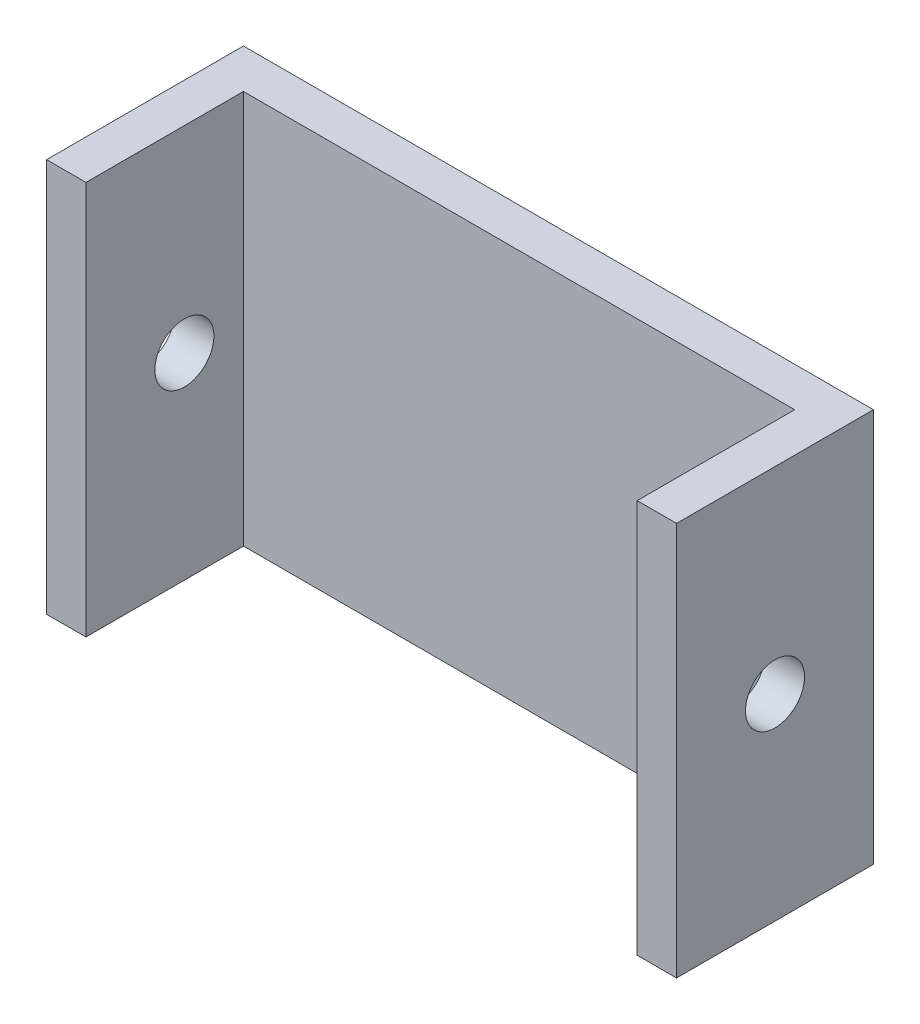
from build123d import *

# Parameters (mm, degrees)
ESQUISSE1_W                  = 28
ESQUISSE1_H                  = 20
BOSS_EXTRU_1_DEPTH           = 2
ESQUISSE2_W                  = 2
ESQUISSE2_H                  = 20
BOSS_EXTRU_2_DEPTH           = 10
ENL_V_MAT_EXTRU_1_DEPTH      = 22.354156504
ENL_V_MAT_EXTRU_1_DEPTH_BACK = 22.354156504
ESQUISSE3_R                  = 1.5


with BuildPart() as part:
    # Esquisse1 → Boss.-Extru.1 (new body)
    with BuildSketch(Plane.XY):
        Rectangle(ESQUISSE1_W, ESQUISSE1_H)
    extrude(amount=BOSS_EXTRU_1_DEPTH)

    # Esquisse2 → Boss.-Extru.2 (add)
    with BuildSketch(Plane.XY):
        with Locations((-15, 0)):
            Rectangle(ESQUISSE2_W, ESQUISSE2_H)
        with Locations((15, 0)):
            Rectangle(ESQUISSE2_W, ESQUISSE2_H)
    extrude(amount=BOSS_EXTRU_2_DEPTH)

    # Esquisse3 → Enlèv. mat.-Extru.1 (cut, two sides: drawn at the far end of the back side and taken through both)
    with BuildSketch(Plane(origin=(0, 0, 0), x_dir=(0, 0, -1), z_dir=(1, 0, 0)).offset(-ENL_V_MAT_EXTRU_1_DEPTH_BACK)):
        with Locations((-5, 0)):
            Circle(ESQUISSE3_R)
    extrude(amount=ENL_V_MAT_EXTRU_1_DEPTH + ENL_V_MAT_EXTRU_1_DEPTH_BACK, mode=Mode.SUBTRACT)


solid = part.part
